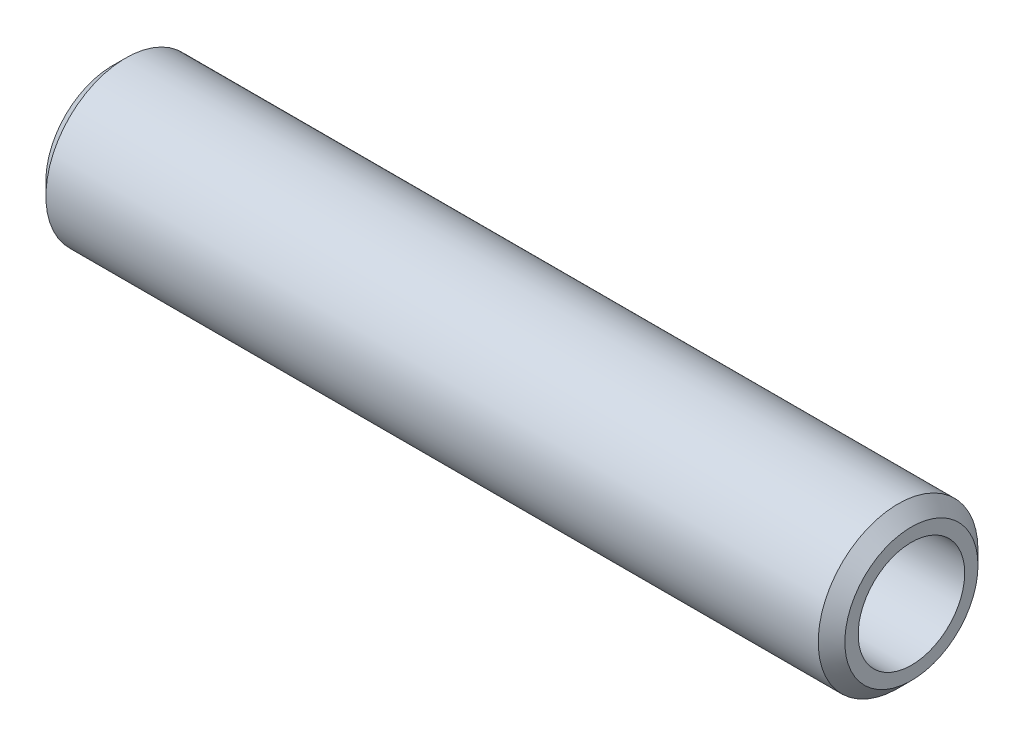
from build123d import *

# Parameters (mm, degrees)
ESQUISSE1_R        = 3
ESQUISSE1_R_2      = 2
BOSS_EXTRU_1_DEPTH = 15
CHANFREIN1_SIZE    = 0.5


with BuildPart() as part:
    # Esquisse1 → Boss.-Extru.1 (new, symmetric)
    with BuildSketch(Plane(origin=(0, 0, 0), x_dir=(0, 0, -1), z_dir=(1, 0, 0))):
        Circle(ESQUISSE1_R)
        Circle(ESQUISSE1_R_2, mode=Mode.SUBTRACT)
    extrude(amount=BOSS_EXTRU_1_DEPTH, both=True)

    # Chanfrein1
    chanfrein1_edges = [part.edges().sort_by_distance(p)[0] for p in [
        (-15, 0, 3),
        (15, 0, 3),
    ]]
    chamfer(chanfrein1_edges, length=CHANFREIN1_SIZE)


solid = part.part
